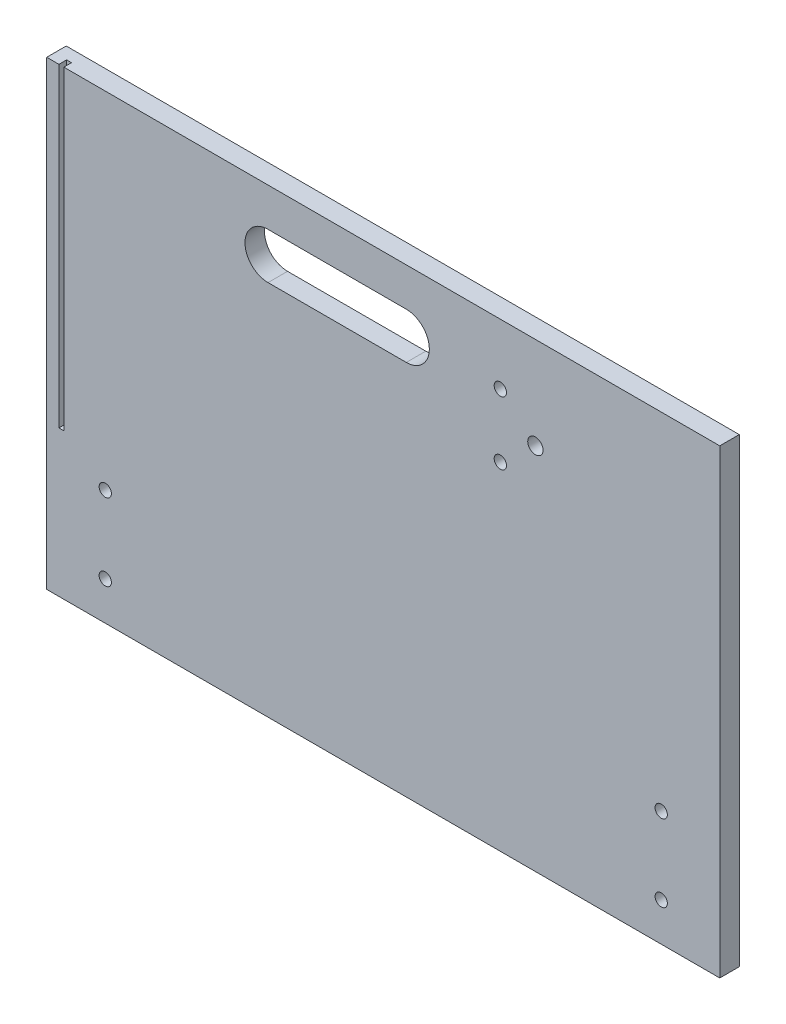
from build123d import *

# Parameters (mm, degrees)
SKETCH1_W           = 438.1
SKETCH1_H           = 300
BOSS_EXTRUDE1_DEPTH = 12.7
CUT_EXTRUDE1_REACH  = 267.79
SKETCH2_R           = 4
SKETCH2_R_2         = 5
SKETCH3_W           = 3.175
SKETCH3_H           = 205
CUT_EXTRUDE2_DEPTH  = 5
CUT_EXTRUDE3_REACH  = 267.79
SKETCH4_R           = 4
CUT_EXTRUDE4_REACH  = 267.79


with BuildPart() as part:
    # Sketch1 → Boss-Extrude1 (new body)
    with BuildSketch(Plane.XY):
        Rectangle(SKETCH1_W, SKETCH1_H)
    extrude(amount=BOSS_EXTRUDE1_DEPTH)

    # Sketch2 → Cut-Extrude1 (cut, up to next)
    with BuildSketch(Plane.XY.offset(12.7), mode=Mode.PRIVATE) as cut_extrude1_sk1:
        with Locations((76.214870385, 69.409934415)):
            Circle(SKETCH2_R)
    cut_extrude1_tool1 = extrude(cut_extrude1_sk1.sketch, amount=-CUT_EXTRUDE1_REACH, mode=Mode.PRIVATE) & part.part
    # Sketch2 → Cut-Extrude1 (cut, up to next)
    with BuildSketch(Plane.XY.offset(12.7), mode=Mode.PRIVATE) as cut_extrude1_sk2:
        with Locations((76.214870385, 110.590065585)):
            Circle(SKETCH2_R)
    cut_extrude1_tool2 = extrude(cut_extrude1_sk2.sketch, amount=-CUT_EXTRUDE1_REACH, mode=Mode.PRIVATE) & part.part
    # Sketch2 → Cut-Extrude1 (cut, up to next)
    with BuildSketch(Plane.XY.offset(12.7), mode=Mode.PRIVATE) as cut_extrude1_sk3:
        with Locations((99.05, 90)):
            Circle(SKETCH2_R_2)
    cut_extrude1_tool3 = extrude(cut_extrude1_sk3.sketch, amount=-CUT_EXTRUDE1_REACH, mode=Mode.PRIVATE) & part.part
    add(cut_extrude1_tool1.solids().sort_by_distance((76.21487, 69.409934, 12.7))[0], mode=Mode.SUBTRACT)
    add(cut_extrude1_tool2.solids().sort_by_distance((76.21487, 110.590066, 12.7))[0], mode=Mode.SUBTRACT)
    add(cut_extrude1_tool3.solids().sort_by_distance((99.05, 90, 12.7))[0], mode=Mode.SUBTRACT)

    # Sketch3 → Cut-Extrude2 (cut)
    with BuildSketch(Plane.XY.offset(12.7)):
        with Locations((-209.525, 47.5)):
            Rectangle(SKETCH3_W, SKETCH3_H)
    extrude(amount=-CUT_EXTRUDE2_DEPTH, mode=Mode.SUBTRACT)

    # Sketch4 → Cut-Extrude3 (cut, up to next)
    with BuildSketch(Plane.XY.offset(12.7), mode=Mode.PRIVATE) as cut_extrude3_sk1:
        with Locations((-180.95, -75)):
            Circle(SKETCH4_R)
    cut_extrude3_tool1 = extrude(cut_extrude3_sk1.sketch, amount=-CUT_EXTRUDE3_REACH, mode=Mode.PRIVATE) & part.part
    # Sketch4 → Cut-Extrude3 (cut, up to next)
    with BuildSketch(Plane.XY.offset(12.7), mode=Mode.PRIVATE) as cut_extrude3_sk2:
        with Locations((-180.95, -125)):
            Circle(SKETCH4_R)
    cut_extrude3_tool2 = extrude(cut_extrude3_sk2.sketch, amount=-CUT_EXTRUDE3_REACH, mode=Mode.PRIVATE) & part.part
    # Sketch4 → Cut-Extrude3 (cut, up to next)
    with BuildSketch(Plane.XY.offset(12.7), mode=Mode.PRIVATE) as cut_extrude3_sk3:
        with Locations((180.95, -125)):
            Circle(SKETCH4_R)
    cut_extrude3_tool3 = extrude(cut_extrude3_sk3.sketch, amount=-CUT_EXTRUDE3_REACH, mode=Mode.PRIVATE) & part.part
    # Sketch4 → Cut-Extrude3 (cut, up to next)
    with BuildSketch(Plane.XY.offset(12.7), mode=Mode.PRIVATE) as cut_extrude3_sk4:
        with Locations((180.95, -75)):
            Circle(SKETCH4_R)
    cut_extrude3_tool4 = extrude(cut_extrude3_sk4.sketch, amount=-CUT_EXTRUDE3_REACH, mode=Mode.PRIVATE) & part.part
    add(cut_extrude3_tool1.solids().sort_by_distance((-180.95, -75, 12.7))[0], mode=Mode.SUBTRACT)
    add(cut_extrude3_tool2.solids().sort_by_distance((-180.95, -125, 12.7))[0], mode=Mode.SUBTRACT)
    add(cut_extrude3_tool3.solids().sort_by_distance((180.95, -125, 12.7))[0], mode=Mode.SUBTRACT)
    add(cut_extrude3_tool4.solids().sort_by_distance((180.95, -75, 12.7))[0], mode=Mode.SUBTRACT)

    # Sketch5 → Cut-Extrude4 (cut, up to next)
    with BuildSketch(Plane.XY.offset(12.7), mode=Mode.PRIVATE) as cut_extrude4_sk1:
        with BuildLine():
            Line((15, 95), (-75, 95))
            ThreePointArc((-75, 95), (-90, 110), (-75, 125))
            Line((-75, 125), (15, 125))
            ThreePointArc((15, 125), (30, 110), (15, 95))
        make_face()
    cut_extrude4_tool1 = extrude(cut_extrude4_sk1.sketch, amount=-CUT_EXTRUDE4_REACH, mode=Mode.PRIVATE) & part.part
    add(cut_extrude4_tool1.solids().sort_by_distance((-30, 110, 12.7))[0], mode=Mode.SUBTRACT)


solid = part.part
